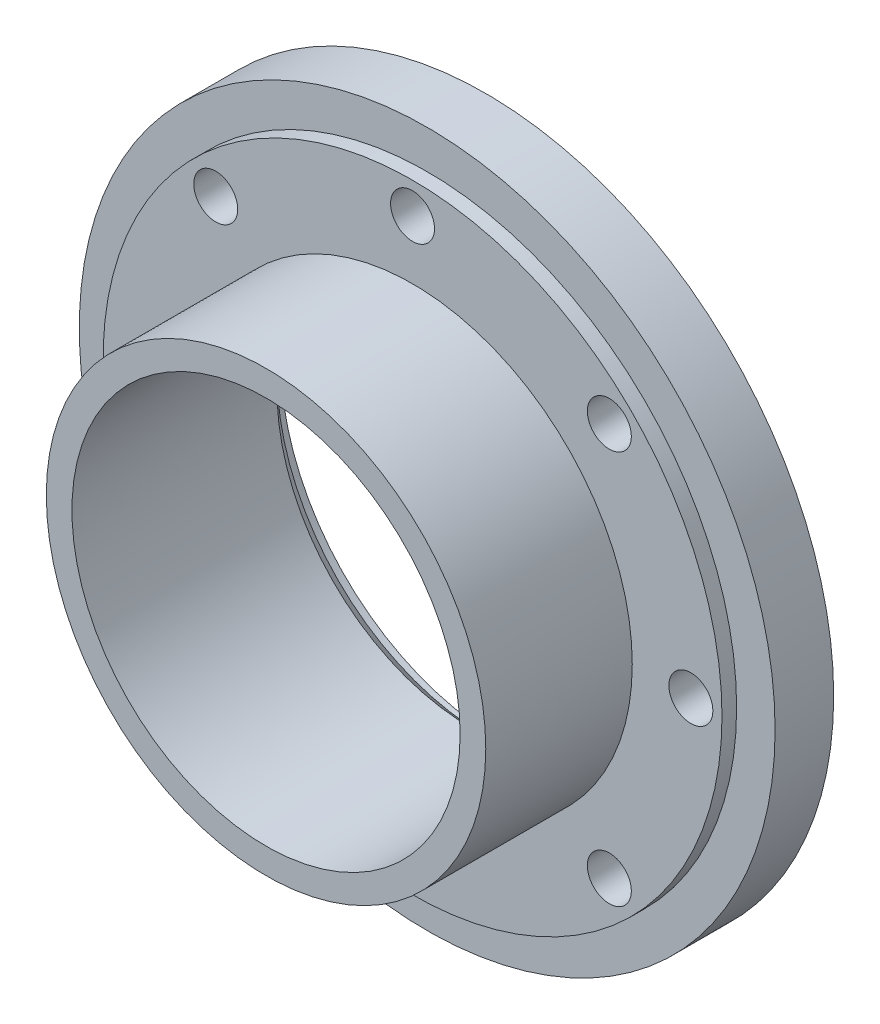
from build123d import *

# Parameters (mm, degrees)
SKETCH_1_R          = 47.5
EXTRUDE_1_DEPTH     = 10
SKETCH_2_R          = 30
EXTRUDE_2_DEPTH     = 20
SKETCH_3_R          = 26.5
CUT_EXTRUDE_1_DEPTH = 40
EXTRUDE_START       = 2
SKETCH_4_R          = 34
SKETCH_4_R_2        = 30
EXTRUDE_3_DEPTH     = 2
CUT_EXTRUDE_START   = -2
SKETCH_5_R          = 47.5
SKETCH_5_R_2        = 42.25
CUT_EXTRUDE_2_DEPTH = 2
SKETCH_6_R          = 3
CUT_EXTRUDE_3_DEPTH = 10
CHAMFER_1_SIZE      = 2


with BuildPart() as part:
    # 草图1 → 拉伸1 (new body)
    with BuildSketch(Plane.XY):
        Circle(SKETCH_1_R)
    extrude(amount=EXTRUDE_1_DEPTH)

    # 草图2 → 拉伸2 (add)
    with BuildSketch(Plane.XY.offset(10)):
        Circle(SKETCH_2_R)
    extrude(amount=EXTRUDE_2_DEPTH)

    # 草图3 → 切除-拉伸1 (cut)
    with BuildSketch(Plane.XY.offset(30)):
        Circle(SKETCH_3_R)
    extrude(amount=-CUT_EXTRUDE_1_DEPTH, mode=Mode.SUBTRACT)

    # 草图4 → 拉伸3 (add)
    with BuildSketch(Plane(origin=(0, 0, 0), x_dir=(-1, 0, 0), z_dir=(0, 0, -1)).offset(EXTRUDE_START)):
        with Locations(Location((0, 0, 0), (0, 0, 180))):
            Circle(SKETCH_4_R)
        with Locations(Location((0, 0, 0), (0, 0, 180))):
            Circle(SKETCH_4_R_2, mode=Mode.SUBTRACT)
    extrude(amount=-EXTRUDE_3_DEPTH)

    # 草图5 → 切除-拉伸2 (cut)
    with BuildSketch(Plane.XY.offset(10).offset(CUT_EXTRUDE_START)):
        Circle(SKETCH_5_R)
        Circle(SKETCH_5_R_2, mode=Mode.SUBTRACT)
    extrude(amount=CUT_EXTRUDE_2_DEPTH, mode=Mode.SUBTRACT)

    # 草图6 → 切除-拉伸3 (cut)
    with BuildSketch(Plane.XY.offset(10)):
        with Locations((26.870057685, 26.870057685)):
            Circle(SKETCH_6_R)
        with Locations((0, 38)):
            Circle(SKETCH_6_R)
        with Locations((38, 0)):
            Circle(SKETCH_6_R)
        with Locations((26.870057685, -26.870057685)):
            Circle(SKETCH_6_R)
        with Locations((0, -38)):
            Circle(SKETCH_6_R)
        with Locations((-26.870057685, -26.870057685)):
            Circle(SKETCH_6_R)
        with Locations((-38, 0)):
            Circle(SKETCH_6_R)
        with Locations((-26.870057685, 26.870057685)):
            Circle(SKETCH_6_R)
    extrude(amount=-CUT_EXTRUDE_3_DEPTH, mode=Mode.SUBTRACT)

    # 倒角1
    chamfer_1_edges = [part.edges().sort_by_distance(p)[0] for p in [
        (-26.5, 0, 0),
    ]]
    chamfer(chamfer_1_edges, length=CHAMFER_1_SIZE)


solid = part.part
